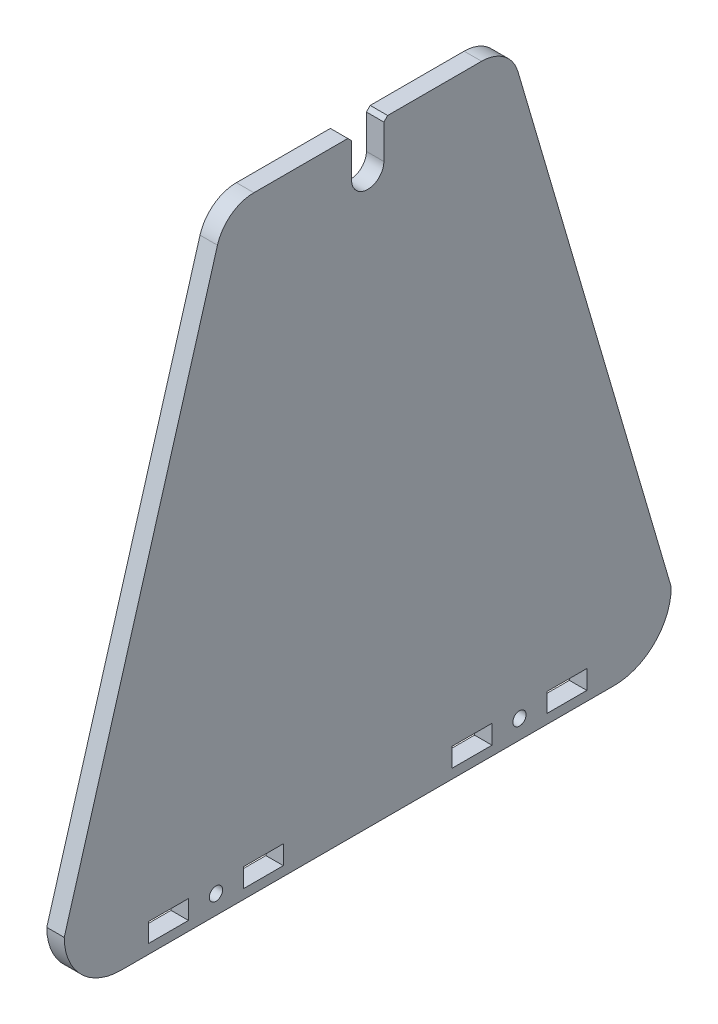
from build123d import *

# Parameters (mm, degrees)
SKETCH1_R      = 1.75
SKETCH1_W      = 10.5
SKETCH1_H      = 5
EXTRUDE1_DEPTH = 4.6


with BuildPart() as part:
    # Sketch1 → Extrude1 (new body)
    with BuildSketch(Plane(origin=(0, 0, 0), x_dir=(0, 0, -1), z_dir=(1, 0, 0))):
        with BuildLine():
            Line((20.003411378, 4.993919491), (150.003411378, 4.993919491))
            ThreePointArc((150.003411378, 4.993919491), (160.610013096, 9.387317773), (165.003411378, 19.993919491))
            Line((165.003411378, 19.993919491), (124.610032516, 157.806623844))
            ThreePointArc((124.610032516, 157.806623844), (121.008451259, 162.997888617), (115.013747077, 164.993919491))
            Line((115.013747077, 164.993919491), (90.253411378, 164.993919491))
            Line((90.253411378, 164.993919491), (89.253411378, 163.993919491))
            Line((89.253411378, 163.993919491), (89.253411378, 154.993919491))
            ThreePointArc((89.253411378, 154.993919491), (85.003411378, 150.743919491), (80.753411378, 154.993919491))
            Line((80.753411378, 154.993919491), (80.753411378, 163.993919491))
            Line((80.753411378, 163.993919491), (79.753411378, 164.993919491))
            Line((79.753411378, 164.993919491), (54.993075679, 164.993919491))
            ThreePointArc((54.993075679, 164.993919491), (48.998371496, 162.997888617), (45.39679024, 157.806623844))
            Line((45.39679024, 157.806623844), (5.003411378, 19.993919491))
            ThreePointArc((5.003411378, 19.993919491), (9.39680966, 9.387317773), (20.003411378, 4.993919491))
        make_face()
        with Locations((45.003411378, 9.993919491)):
            Circle(SKETCH1_R, mode=Mode.SUBTRACT)
        with Locations((125.003411378, 9.993919491)):
            Circle(SKETCH1_R, mode=Mode.SUBTRACT)
        with Locations((32.503411378, 9.993919491)):
            Rectangle(SKETCH1_W, SKETCH1_H, mode=Mode.SUBTRACT)
        with Locations((57.503411378, 9.993919491)):
            Rectangle(SKETCH1_W, SKETCH1_H, mode=Mode.SUBTRACT)
        with Locations((137.503411378, 9.993919491)):
            Rectangle(SKETCH1_W, SKETCH1_H, mode=Mode.SUBTRACT)
        with Locations((112.503411378, 9.993919491)):
            Rectangle(SKETCH1_W, SKETCH1_H, mode=Mode.SUBTRACT)
    extrude(amount=EXTRUDE1_DEPTH)


solid = part.part
